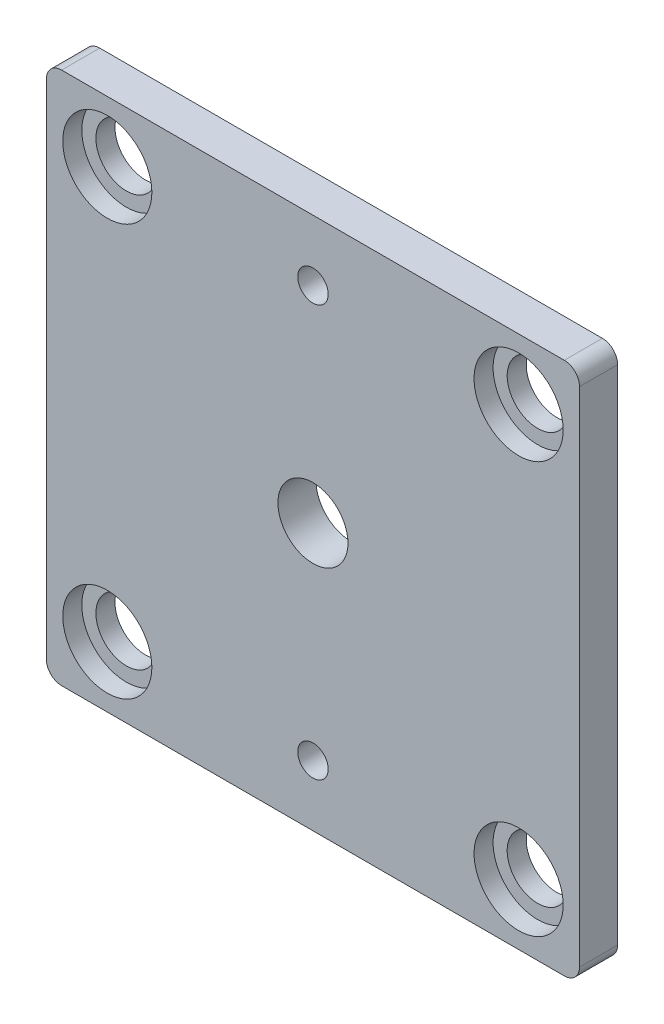
from build123d import *

# Parameters (mm, degrees)
SKETCH1_W           = 70
SKETCH1_H           = 70
SKETCH1_R           = 4.6
SKETCH1_R_2         = 2
SKETCH1_R_3         = 4
BOSS_EXTRUDE1_DEPTH = 5
FILLET1_R           = 2
FILLET2_R           = 2
SKETCH2_R           = 5.85
CUT_EXTRUDE1_DEPTH  = 2.5


with BuildPart() as part:
    # Sketch1 → Boss-Extrude1 (new body)
    with BuildSketch(Plane.XY):
        Rectangle(SKETCH1_W, SKETCH1_H)
        Circle(SKETCH1_R, mode=Mode.SUBTRACT)
        with Locations((0, 27)):
            Circle(SKETCH1_R_2, mode=Mode.SUBTRACT)
        with Locations((0, -27)):
            Circle(SKETCH1_R_2, mode=Mode.SUBTRACT)
        with Locations((-27, 27)):
            Circle(SKETCH1_R_3, mode=Mode.SUBTRACT)
        with Locations((27, 27)):
            Circle(SKETCH1_R_3, mode=Mode.SUBTRACT)
        with Locations((27, -27)):
            Circle(SKETCH1_R_3, mode=Mode.SUBTRACT)
        with Locations((-27, -27)):
            Circle(SKETCH1_R_3, mode=Mode.SUBTRACT)
    extrude(amount=BOSS_EXTRUDE1_DEPTH)

    # Fillet1
    fillet1_edges = [part.edges().sort_by_distance(p)[0] for p in [
        (-35, 35, 2.5),
        (35, 35, 2.5),
        (35, -35, 2.5),
    ]]
    fillet(fillet1_edges, radius=FILLET1_R)

    # Fillet2
    fillet2_edges = [part.edges().sort_by_distance(p)[0] for p in [
        (-35, -35, 2.5),
    ]]
    fillet(fillet2_edges, radius=FILLET2_R)

    # Sketch2 → Cut-Extrude1 (cut)
    with BuildSketch(Plane.XY.offset(5)):
        with Locations((-27, 27)):
            Circle(SKETCH2_R)
        with Locations((27, 27)):
            Circle(SKETCH2_R)
        with Locations((27, -27)):
            Circle(SKETCH2_R)
        with Locations((-27, -27)):
            Circle(SKETCH2_R)
    extrude(amount=-CUT_EXTRUDE1_DEPTH, mode=Mode.SUBTRACT)


solid = part.part
